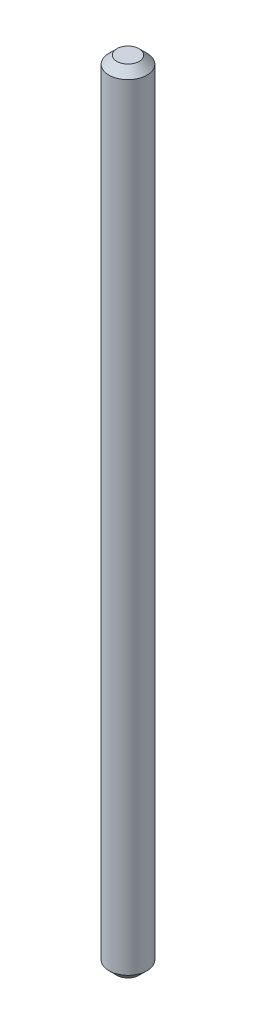
from build123d import *

# Parameters (mm, degrees)
SKETCH1_R           = 3.048
BOSS_EXTRUDE1_DEPTH = 127
CHAMFER1_SIZE       = 1.27
CHAMFER2_SIZE       = 1.27


with BuildPart() as part:
    # Sketch1 → Boss-Extrude1 (new body)
    with BuildSketch(Plane(origin=(0, 0, 0), x_dir=(1, 0, 0), z_dir=(0, 1, 0))):
        with Locations(Location((0, 0, 0), (0, 0, 270))):
            Circle(SKETCH1_R)
    extrude(amount=BOSS_EXTRUDE1_DEPTH)

    # Chamfer1
    chamfer1_edges = [part.edges().sort_by_distance(p)[0] for p in [
        (0, 127, -3.048),
    ]]
    chamfer(chamfer1_edges, length=CHAMFER1_SIZE)

    # Chamfer2
    chamfer2_edges = [part.edges().sort_by_distance(p)[0] for p in [
        (0, 0, -3.048),
    ]]
    chamfer(chamfer2_edges, length=CHAMFER2_SIZE)


solid = part.part
